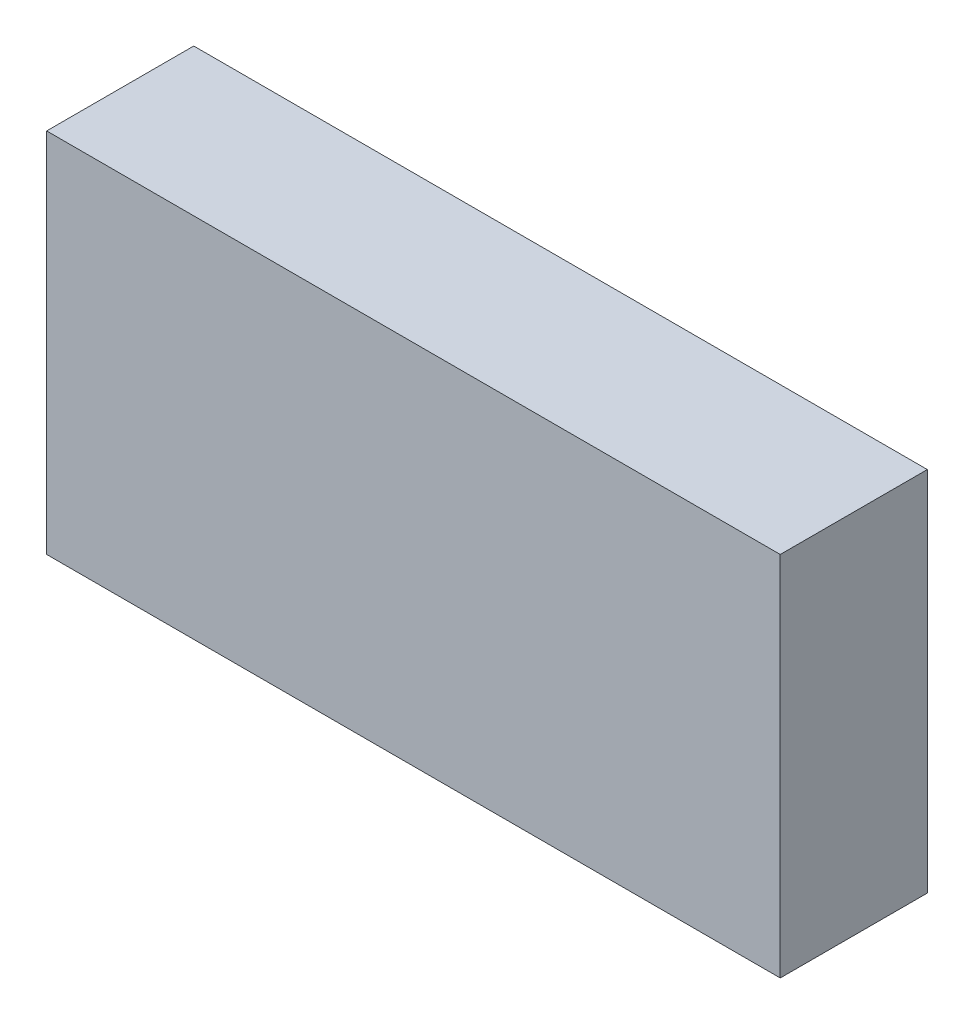
from build123d import *

# Parameters (mm, degrees)
SKETCH1_W           = 100.076
SKETCH1_H           = 20.066
BOSS_EXTRUDE1_DEPTH = 50.038


with BuildPart() as part:
    # Sketch1 → Boss-Extrude1 (new body)
    with BuildSketch(Plane(origin=(0, 0, 0), x_dir=(1, 0, 0), z_dir=(0, 1, 0))):
        with Locations((50.038, 10.033)):
            Rectangle(SKETCH1_W, SKETCH1_H)
    extrude(amount=BOSS_EXTRUDE1_DEPTH)


solid = part.part
